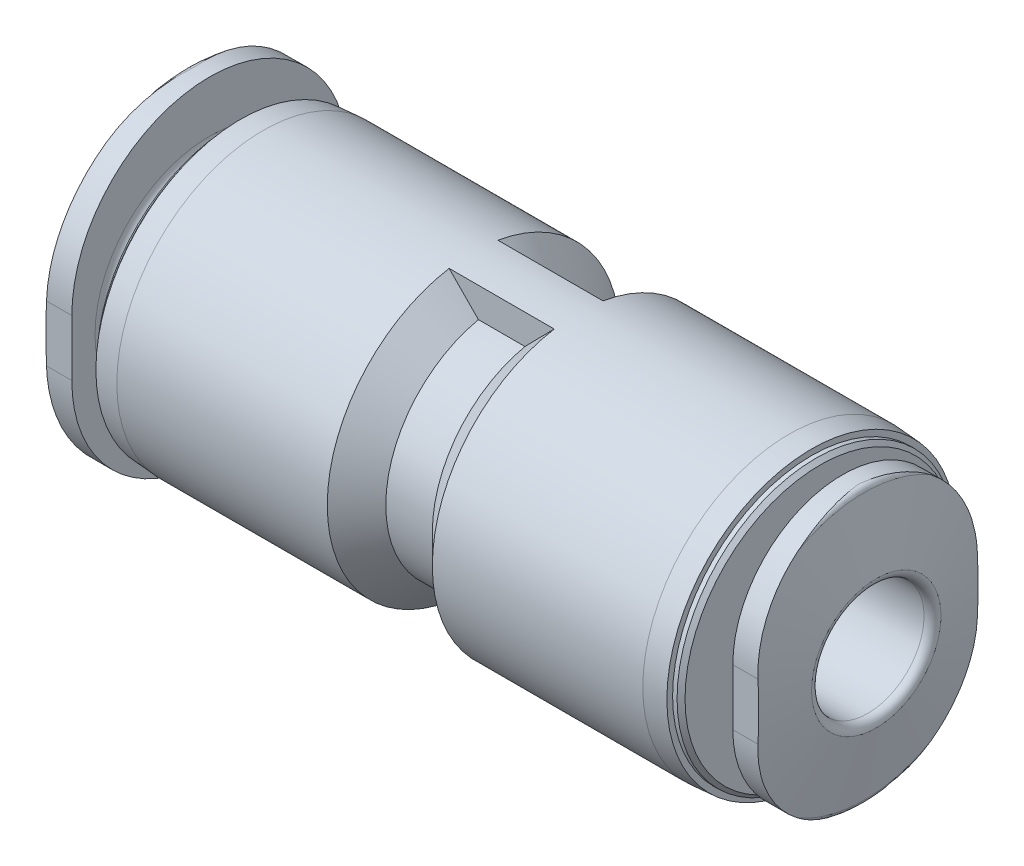
from build123d import *

# Parameters (mm, degrees)
SKIZZE2_W                            = 14.16
SKIZZE2_H                            = 14.16
SCHNITT_LINEAR_AUSTRAGEN1_DEPTH      = 1.2
SKIZZE3_W                            = 14.16
SKIZZE3_H                            = 14.16
SCHNITT_LINEAR_AUSTRAGEN2_DEPTH      = 1.2
AUFSATZ_LINEAR_AUSTRAGEN1_DEPTH      = 1.8675
AUFSATZ_LINEAR_AUSTRAGEN1_DEPTH_BACK = 1.8675
SKIZZE4_R                            = 3.12


with BuildPart() as part:
    # Skizze1 → Rotation1 (revolve)
    with BuildSketch(Plane(origin=(0, 0, 0), x_dir=(1, 0, 0), z_dir=(0, 1, 0)), mode=Mode.PRIVATE) as rotation1_sk:
        with BuildLine():
            Line((-12.45, 0), (-12.45, 3.3))
            Line((-12.45, 3.3), (-12.020691475, 5.734729636))
            ThreePointArc((-12.020691475, 5.734729636), (-11.952287446, 5.853208889), (-11.823729924, 5.9))
            Line((-11.823729924, 5.9), (-11.25, 5.9))
            Line((-11.25, 5.9), (-11.25, 4.075))
            ThreePointArc((-11.25, 4.075), (-11.140165043, 3.809834957), (-10.875, 3.7))
            Line((-10.875, 3.7), (-10.45, 3.7))
            Line((-10.45, 3.7), (-10.45, 4.798578644))
            Line((-10.45, 4.798578644), (-10.308578644, 4.94))
            Line((-10.308578644, 4.94), (-10.15, 4.94))
            Line((-10.15, 4.94), (-10.15, 5.14405855))
            Line((-10.15, 5.14405855), (-9.35, 5.2))
            Line((-9.35, 5.2), (-1.8675, 5.2))
            Line((-1.8675, 5.2), (-0.8275, 4.16))
            Line((-0.8275, 4.16), (0.8275, 4.16))
            Line((0.8275, 4.16), (1.8675, 5.2))
            Line((1.8675, 5.2), (9.35, 5.2))
            Line((9.35, 5.2), (10.15, 5.14405855))
            Line((10.15, 5.14405855), (10.15, 4.94))
            Line((10.15, 4.94), (10.308578644, 4.94))
            Line((10.308578644, 4.94), (10.45, 4.798578644))
            Line((10.45, 4.798578644), (10.45, 2.5))
            Line((10.45, 2.5), (10.875, 2.5))
            ThreePointArc((10.875, 2.5), (11.140165043, 2.609834957), (11.25, 2.875))
            Line((11.25, 2.875), (11.25, 4.9))
            Line((11.25, 4.9), (11.823729924, 4.9))
            ThreePointArc((11.823729924, 4.9), (11.952287446, 4.853208889), (12.020691475, 4.734729636))
            Line((12.020691475, 4.734729636), (12.45, 2.3))
            Line((12.45, 2.3), (12.45, 0))
            Line((12.45, 0), (-12.45, 0))
        make_face()
    revolve(rotation1_sk.sketch.rotate(Axis((12.45, 0, 0), (-1, 0, 0)), 180), axis=Axis((12.45, 0, 0), (-1, 0, 0)))

    # Skizze2 → Schnitt-Linear austragen1 (cut)
    with BuildSketch(Plane(origin=(12.45, 0, 0), x_dir=(0, 0, -1), z_dir=(1, 0, 0))):
        Rectangle(SKIZZE2_W, SKIZZE2_H)
        with BuildLine():
            Line((3.9, -1), (3.9, 1))
            ThreePointArc((3.9, 1), (0, 4.9), (-3.9, 1))
            Line((-3.9, 1), (-3.9, -1))
            ThreePointArc((-3.9, -1), (0, -4.9), (3.9, -1))
        make_face(mode=Mode.SUBTRACT)
    extrude(amount=-SCHNITT_LINEAR_AUSTRAGEN1_DEPTH, mode=Mode.SUBTRACT)

    # Skizze3 → Schnitt-Linear austragen2 (cut)
    with BuildSketch(Plane(origin=(-12.45, 0, 0), x_dir=(0, 0, -1), z_dir=(1, 0, 0))):
        Rectangle(SKIZZE3_W, SKIZZE3_H)
        with BuildLine():
            Line((4.9, -1), (4.9, 1))
            ThreePointArc((4.9, 1), (0, 5.9), (-4.9, 1))
            Line((-4.9, 1), (-4.9, -1))
            ThreePointArc((-4.9, -1), (0, -5.9), (4.9, -1))
        make_face(mode=Mode.SUBTRACT)
    extrude(amount=SCHNITT_LINEAR_AUSTRAGEN2_DEPTH, mode=Mode.SUBTRACT)

    # Skizze4 → Aufsatz-Linear austragen1 (add, two sides: drawn at the far end of the back side and taken through both)
    with BuildSketch(Plane(origin=(0, 0, 0), x_dir=(0, 0, -1), z_dir=(1, 0, 0)).offset(-AUFSATZ_LINEAR_AUSTRAGEN1_DEPTH_BACK)):
        with BuildLine():
            Line((-0.866666667, -3.802484568), (-0.866666667, -5.127269145))
            ThreePointArc((-0.866666667, -5.127269145), (0, -5.2), (0.866666667, -5.127269145))
            Line((0.866666667, -5.127269145), (0.866666667, -3.802484568))
            ThreePointArc((0.866666667, -3.802484568), (3.9, 0), (0.866666667, 3.802484568))
            Line((0.866666667, 3.802484568), (0.866666667, 5.127269145))
            ThreePointArc((0.866666667, 5.127269145), (0, 5.2), (-0.866666667, 5.127269145))
            Line((-0.866666667, 5.127269145), (-0.866666667, 3.802484568))
            ThreePointArc((-0.866666667, 3.802484568), (-3.9, 0), (-0.866666667, -3.802484568))
        make_face()
        Circle(SKIZZE4_R, mode=Mode.SUBTRACT)
    extrude(amount=AUFSATZ_LINEAR_AUSTRAGEN1_DEPTH + AUFSATZ_LINEAR_AUSTRAGEN1_DEPTH_BACK)

    # Skizze5 → Schnitt-Rotation1 (revolve, cut)
    with BuildSketch(Plane.XY, mode=Mode.PRIVATE) as schnitt_rotation1_sk:
        with BuildLine():
            Line((-12.45, 0), (-12.45, 3.3))
            ThreePointArc((-12.45, 3.3), (-12.362132034, 3.087867966), (-12.15, 3))
            Line((-12.15, 3), (-0.85, 3))
            Line((-0.85, 3), (-0.85, 1.5))
            Line((-0.85, 1.5), (0.85, 1.5))
            Line((0.85, 1.5), (0.85, 2))
            Line((0.85, 2), (12.15, 2))
            ThreePointArc((12.15, 2), (12.362132034, 2.087867966), (12.45, 2.3))
            Line((12.45, 2.3), (12.45, 0))
            Line((12.45, 0), (-12.45, 0))
        make_face()
    revolve(schnitt_rotation1_sk.sketch.rotate(Axis((12.45, 0, 0), (-1, 0, 0)), 270), axis=Axis((12.45, 0, 0), (-1, 0, 0)), mode=Mode.SUBTRACT)


solid = part.part
